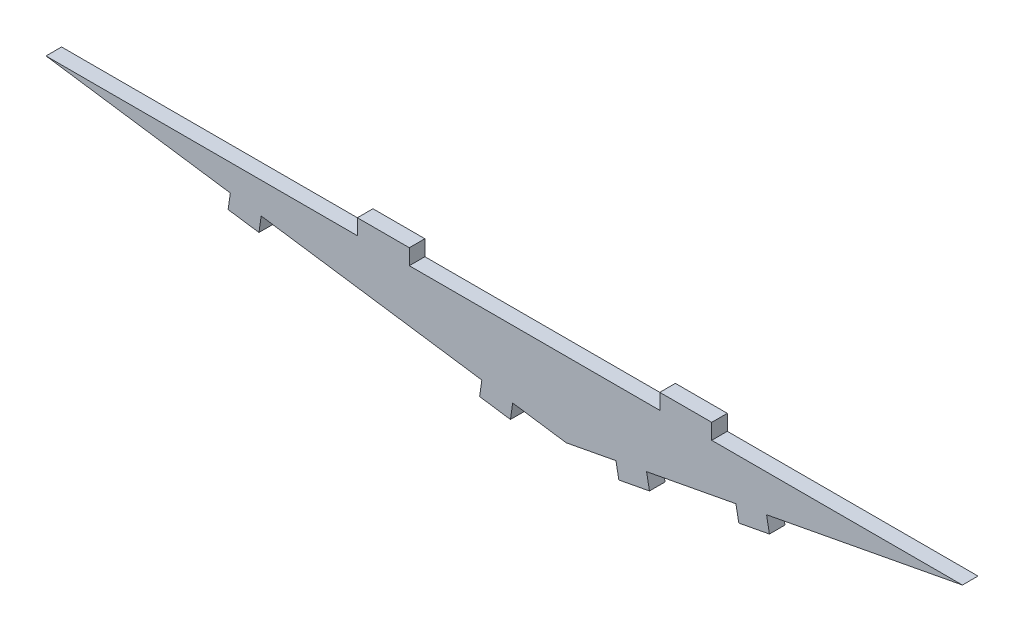
from build123d import *

# Parameters (mm, degrees)
BOSS_EXTRUDE1_DEPTH = 1.524


with BuildPart() as part:
    # Sketch1 → Boss-Extrude1 (new body)
    with BuildSketch(Plane.XY):
        Polygon((-9.60258928, -1.524), (-28.761615364, -5.146272329), (-28.478498191, -6.643743753), (-31.47344104, -7.209978099), (-31.756558213, -5.712506675), (-40.495294208, -7.364682597), (-40.212177035, -8.862154021), (-43.207119883, -9.428388367), (-43.490237056, -7.930916943), (-48.355985293, -8.850852284), (-53.593355447, -8.096704042), (-53.810561584, -9.605146117), (-56.827445734, -9.170733844), (-56.610239597, -7.662291769), (-78.191926721, -4.554665056), (-78.409132858, -6.063107132), (-81.426017008, -5.628694858), (-81.208810872, -4.120252783), (-99.239134473, -1.524), (-68.783094529, -1.524), (-68.783094529, 0), (-63.703094529, 0), (-63.703094529, -1.524), (-39.202780194, -1.524), (-39.202780194, 0), (-34.122780194, 0), (-34.122780194, -1.524), align=None)
    extrude(amount=-BOSS_EXTRUDE1_DEPTH)


solid = part.part
